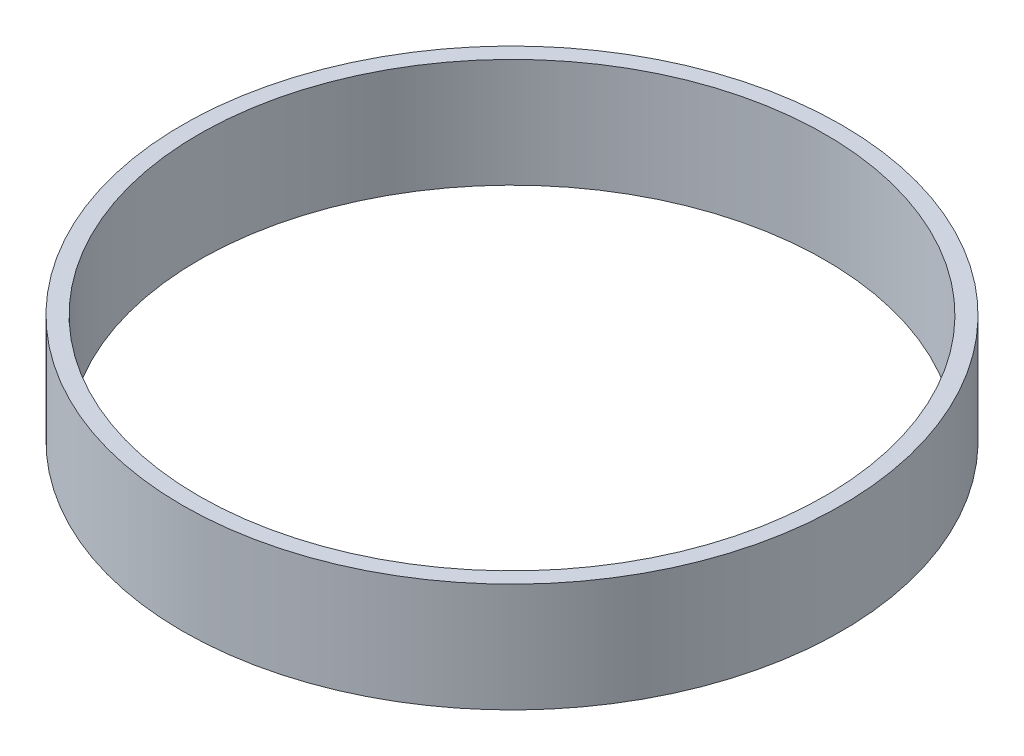
from build123d import *

# Parameters (mm, degrees)
BASE_R                                               = 121
BASE_R_2                                             = 115
BASE_EXTRUDE_DEPTH                                   = 40
CSK_FOR_M5_COUNTERSUNK_RAISED_HEAD_SCREW_D           = 5.5
CSK_FOR_M5_COUNTERSUNK_RAISED_HEAD_SCREW_DEPTH       = 20
CSK_FOR_M5_COUNTERSUNK_RAISED_HEAD_SCREW_CSINK_D     = 10.4
CSK_FOR_M5_COUNTERSUNK_RAISED_HEAD_SCREW_CSINK_ANGLE = 90
CSK_FOR_M5_COUNTERSUNK_RAISED_HEAD_SCREW_TIP         = 1.652366702


with BuildPart() as part:
    # Base → Base-Extrude (new body)
    with BuildSketch(Plane(origin=(0, 0, 0), x_dir=(1, 0, 0), z_dir=(0, 1, 0))):
        with Locations(Location((0, 0, 0), (0, 0, 270))):
            Circle(BASE_R)
        with Locations(Location((0, 0, 0), (0, 0, 270))):
            Circle(BASE_R_2, mode=Mode.SUBTRACT)
    extrude(amount=BASE_EXTRUDE_DEPTH)

    # CSK for M5 Countersunk Raised Head Screw1
    with Locations(Plane(origin=(37.968714772, -4, -14.434938782), x_dir=(-1, 0, 0), z_dir=(0, -1, 0))):
        with Locations((-45.469885408, -97.873538962), (-80.031285228, -14.434938782), (-45.469885408, 69.003661398), (37.968714772, 103.565061218), (121.407314952, 69.003661398), (155.968714772, -14.434938782), (121.407314952, -97.873538962), (37.968714772, -132.434938782)):
            CounterSinkHole(CSK_FOR_M5_COUNTERSUNK_RAISED_HEAD_SCREW_D / 2, CSK_FOR_M5_COUNTERSUNK_RAISED_HEAD_SCREW_CSINK_D / 2, depth=CSK_FOR_M5_COUNTERSUNK_RAISED_HEAD_SCREW_DEPTH, counter_sink_angle=CSK_FOR_M5_COUNTERSUNK_RAISED_HEAD_SCREW_CSINK_ANGLE)
            with Locations((0, 0, -(CSK_FOR_M5_COUNTERSUNK_RAISED_HEAD_SCREW_DEPTH + CSK_FOR_M5_COUNTERSUNK_RAISED_HEAD_SCREW_TIP / 2))):  # 118° drill point
                Cone(0, CSK_FOR_M5_COUNTERSUNK_RAISED_HEAD_SCREW_D / 2, CSK_FOR_M5_COUNTERSUNK_RAISED_HEAD_SCREW_TIP, mode=Mode.SUBTRACT)


solid = part.part
